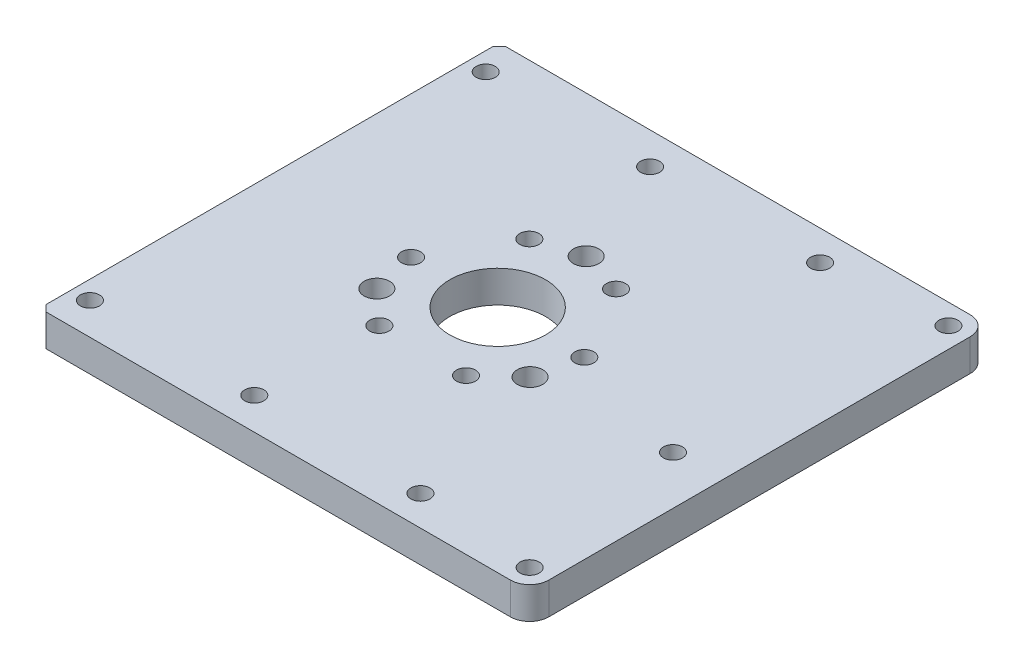
from build123d import *

# Parameters (mm, degrees)
SKETCH_1_R               = 7.5
SKETCH_1_R_2             = 1.5
SKETCH_1_R_3             = 2
EXTRUDE_1_DEPTH          = 5
EXTRUDE_2_DEPTH          = 5
CUT_EXTRUDE_1_DEPTH      = 55.790510127
CUT_EXTRUDE_1_DEPTH_BACK = 55.790510127
SKETCH_4_W               = 18.755882419
SKETCH_4_H               = 70
CUT_EXTRUDE_2_DEPTH      = 55.790510127
CUT_EXTRUDE_2_DEPTH_BACK = 55.790510127
SKETCH_5_R               = 1.5
CUT_EXTRUDE_3_DEPTH      = 55.790510127
CUT_EXTRUDE_3_DEPTH_BACK = 55.790510127
SKETCH_7_R               = 1.5
SKETCH_8_R               = 3
CUT_EXTRUDE_4_DEPTH      = 1.7


with BuildPart() as part:
    # 草图1 → 凸台-拉伸1 (new body)
    with BuildSketch(Plane(origin=(0, 0, 0), x_dir=(1, 0, 0), z_dir=(0, 1, 0))):
        with BuildLine():
            Line((0, 36), (38, 36))
            ThreePointArc((38, 36), (40.121320344, 35.121320344), (41, 33))
            Line((41, 33), (41, -33))
            ThreePointArc((41, -33), (40.121320344, -35.121320344), (38, -36))
            Line((38, -36), (0, -36))
            ThreePointArc((0, -36), (-36, 0), (0, 36))
        make_face()
        with Locations(Location((0, 0, 0), (0, 0, 270))):
            Circle(SKETCH_1_R, mode=Mode.SUBTRACT)
        with Locations(Location((-6.783865663, 11.75, 0), (0, 0, 270))):
            Circle(SKETCH_1_R_2, mode=Mode.SUBTRACT)
        with Locations(Location((6.783865663, 11.75, 0), (0, 0, 270))):
            Circle(SKETCH_1_R_2, mode=Mode.SUBTRACT)
        with Locations(Location((13.567731326, 0, 0), (0, 0, 270))):
            Circle(SKETCH_1_R_2, mode=Mode.SUBTRACT)
        with Locations(Location((6.783865663, -11.75, 0), (0, 0, 270))):
            Circle(SKETCH_1_R_2, mode=Mode.SUBTRACT)
        with Locations(Location((-6.783865663, -11.75, 0), (0, 0, 270))):
            Circle(SKETCH_1_R_2, mode=Mode.SUBTRACT)
        with Locations(Location((-13.567731326, 0, 0), (0, 0, 270))):
            Circle(SKETCH_1_R_2, mode=Mode.SUBTRACT)
        with Locations(Location((-12, -6.92820323, 0), (0, 0, 270))):
            Circle(SKETCH_1_R_3, mode=Mode.SUBTRACT)
        with Locations(Location((0, 13.856406461, 0), (0, 0, 270))):
            Circle(SKETCH_1_R_3, mode=Mode.SUBTRACT)
        with Locations(Location((12, -6.92820323, 0), (0, 0, 270))):
            Circle(SKETCH_1_R_3, mode=Mode.SUBTRACT)
    extrude(amount=EXTRUDE_1_DEPTH)

    # 草图3 → 凸台-拉伸2 (add)
    with BuildSketch(Plane(origin=(0, 5, 0), x_dir=(1, 0, 0), z_dir=(0, 1, 0))):
        with BuildLine():
            Line((0, 36), (-34.75, 36))
            Line((-34.75, 36), (-35.75, 35))
            Line((-35.75, 35), (-35.75, -35))
            Line((-35.75, -35), (-34.75, -36))
            Line((-34.75, -36), (0, -36))
            ThreePointArc((0, -36), (-34.929573093, 0), (0, 36))
        make_face()
    extrude(amount=-EXTRUDE_2_DEPTH)

    # 草图4 → 切除-拉伸1 (cut, two sides: drawn at the far end of the back side and taken through both)
    with BuildSketch(Plane.XZ.offset(-CUT_EXTRUDE_1_DEPTH_BACK)):
        with Locations((-45.12794121, 0)):
            Rectangle(SKETCH_4_W, SKETCH_4_H)
    extrude(amount=CUT_EXTRUDE_1_DEPTH + CUT_EXTRUDE_1_DEPTH_BACK, mode=Mode.SUBTRACT)

    # 草图5 → 切除-拉伸2 (cut, two sides: drawn at the far end of the back side and taken through both)
    with BuildSketch(Plane(origin=(0, 5, 0), x_dir=(1, 0, 0), z_dir=(0, 1, 0)).offset(-CUT_EXTRUDE_2_DEPTH_BACK)):
        with Locations(Location((-7.125, -31, 0), (0, 0, 270))):
            Circle(SKETCH_5_R)
        with Locations(Location((-32.875, -31, 0), (0, 0, 270))):
            Circle(SKETCH_5_R)
        with Locations(Location((-7.125, 31, 0), (0, 0, 270))):
            Circle(SKETCH_5_R)
        with Locations(Location((-32.875, 31, 0), (0, 0, 270))):
            Circle(SKETCH_5_R)
    extrude(amount=CUT_EXTRUDE_2_DEPTH + CUT_EXTRUDE_2_DEPTH_BACK, mode=Mode.SUBTRACT)

    # 草图7 → 切除-拉伸3 (cut, two sides: drawn at the far end of the back side and taken through both)
    with BuildSketch(Plane.XZ.offset(-CUT_EXTRUDE_3_DEPTH_BACK)):
        with Locations(Location((37.8, -32.8, 0), (0, 0, 270))):
            Circle(SKETCH_7_R)
        with Locations(Location((19.2, -31.3, 0), (0, 0, 270))):
            Circle(SKETCH_7_R)
        with Locations(Location((33.412894333, 5.952122667, 0), (0, 0, 270))):
            Circle(SKETCH_7_R)
        with Locations(Location((37.8, 32.8, 0), (0, 0, 270))):
            Circle(SKETCH_7_R)
        with Locations(Location((19.2, 31.3, 0), (0, 0, 270))):
            Circle(SKETCH_7_R)
    extrude(amount=CUT_EXTRUDE_3_DEPTH + CUT_EXTRUDE_3_DEPTH_BACK, mode=Mode.SUBTRACT)

    # 草图8 → 切除-拉伸4 (cut)
    with BuildSketch(Plane.XZ):
        with Locations(Location((-7.125, 31, 0), (0, 0, 270))):
            Circle(SKETCH_8_R)
        with Locations(Location((-7.125, -31, 0), (0, 0, 270))):
            Circle(SKETCH_8_R)
    extrude(amount=-CUT_EXTRUDE_4_DEPTH, mode=Mode.SUBTRACT)


solid = part.part
